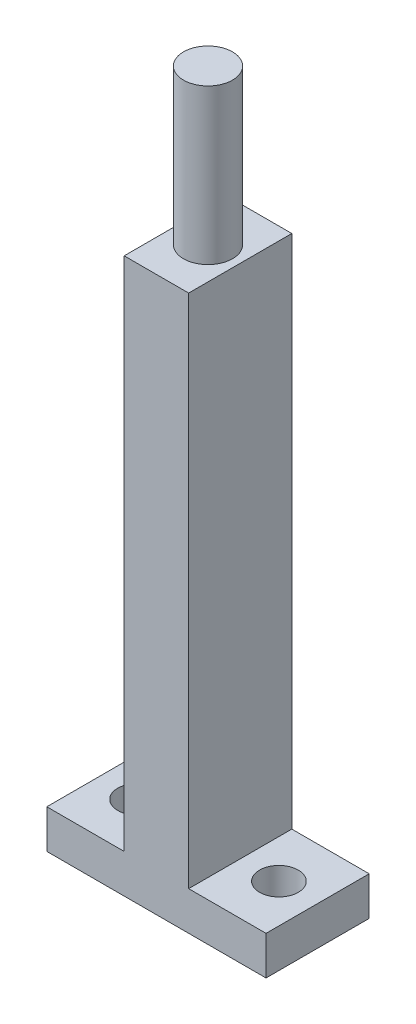
from build123d import *

# Parameters (mm, degrees)
SKETCH1_R           = 1.9
BOSS_EXTRUDE1_DEPTH = 55
SKETCH2_W           = 17
SKETCH2_H           = 8
BOSS_EXTRUDE2_DEPTH = 3
SKETCH3_R           = 1.5
CUT_EXTRUDE1_DEPTH  = 53.841744861
SKETCH4_W           = 5
SKETCH4_H           = 8
BOSS_EXTRUDE3_DEPTH = 40


with BuildPart() as part:
    # Sketch1 → Boss-Extrude1 (new body)
    with BuildSketch(Plane(origin=(0, 0, 0), x_dir=(1, 0, 0), z_dir=(0, 1, 0))):
        with Locations(Location((0, 0, 0), (0, 0, 270))):
            Circle(SKETCH1_R)
    extrude(amount=BOSS_EXTRUDE1_DEPTH)

    # Sketch2 → Boss-Extrude2 (add)
    with BuildSketch(Plane.XZ):
        Rectangle(SKETCH2_W, SKETCH2_H)
    extrude(amount=-BOSS_EXTRUDE2_DEPTH)

    # Sketch3 → Cut-Extrude1 (cut, through all)
    with BuildSketch(Plane(origin=(0, 3, 0), x_dir=(1, 0, 0), z_dir=(0, 1, 0))):
        with Locations(Location((-5.5, 0, 0), (0, 0, 270))):
            Circle(SKETCH3_R)
        with Locations(Location((5.5, 0, 0), (0, 0, 90))):
            Circle(SKETCH3_R)
    extrude(amount=-CUT_EXTRUDE1_DEPTH, mode=Mode.SUBTRACT)

    # Sketch4 → Boss-Extrude3 (add)
    with BuildSketch(Plane(origin=(0, 3, 0), x_dir=(1, 0, 0), z_dir=(0, 1, 0))):
        Rectangle(SKETCH4_W, SKETCH4_H)
    extrude(amount=BOSS_EXTRUDE3_DEPTH)


solid = part.part
